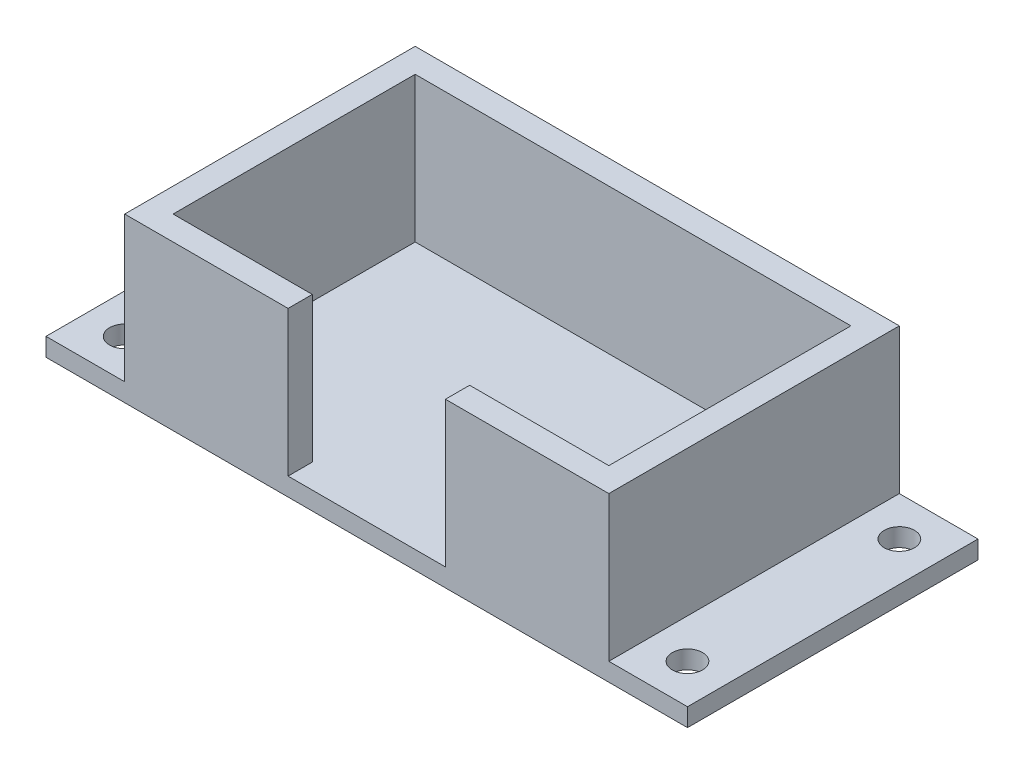
from build123d import *

# Parameters (mm, degrees)
SKETCH1_W           = 106
SKETCH1_H           = 48
SKETCH1_R           = 2.5
BOSS_EXTRUDE3_DEPTH = 3
BOSS_EXTRUDE4_DEPTH = 24


with BuildPart() as part:
    # Sketch1 → Boss-Extrude3 (new body)
    with BuildSketch(Plane(origin=(0, 0, 0), x_dir=(1, 0, 0), z_dir=(0, 1, 0))):
        with Locations((-8.19327026, 12.513208654)):
            Rectangle(SKETCH1_W, SKETCH1_H)
        with Locations(Location((-54.723551999, 30.013208654, 0), (0, 0, 270))):
            Circle(SKETCH1_R, mode=Mode.SUBTRACT)
        with Locations(Location((-54.690171501, -4.986791346, 0), (0, 0, 270))):
            Circle(SKETCH1_R, mode=Mode.SUBTRACT)
        with Locations(Location((38.31560417, 30.013208654, 0), (0, 0, 270))):
            Circle(SKETCH1_R, mode=Mode.SUBTRACT)
        with Locations(Location((38.297946807, -4.986791346, 0), (0, 0, 270))):
            Circle(SKETCH1_R, mode=Mode.SUBTRACT)
    extrude(amount=BOSS_EXTRUDE3_DEPTH)

    # Sketch3 → Boss-Extrude4 (add)
    with BuildSketch(Plane(origin=(0, 3, 0), x_dir=(1, 0, 0), z_dir=(0, 1, 0))):
        Polygon((-44.19327026, 32.513208654), (-44.19327026, -7.486791346), (-21.19327026, -7.486791346), (-21.19327026, -11.486791346), (-48.19327026, -11.486791346), (-48.19327026, 36.513208654), (31.80672974, 36.513208654), (31.80672974, -11.486791346), (4.80672974, -11.486791346), (4.80672974, -7.486791346), (27.80672974, -7.486791346), (27.80672974, 32.513208654), align=None)
    extrude(amount=BOSS_EXTRUDE4_DEPTH)


solid = part.part
